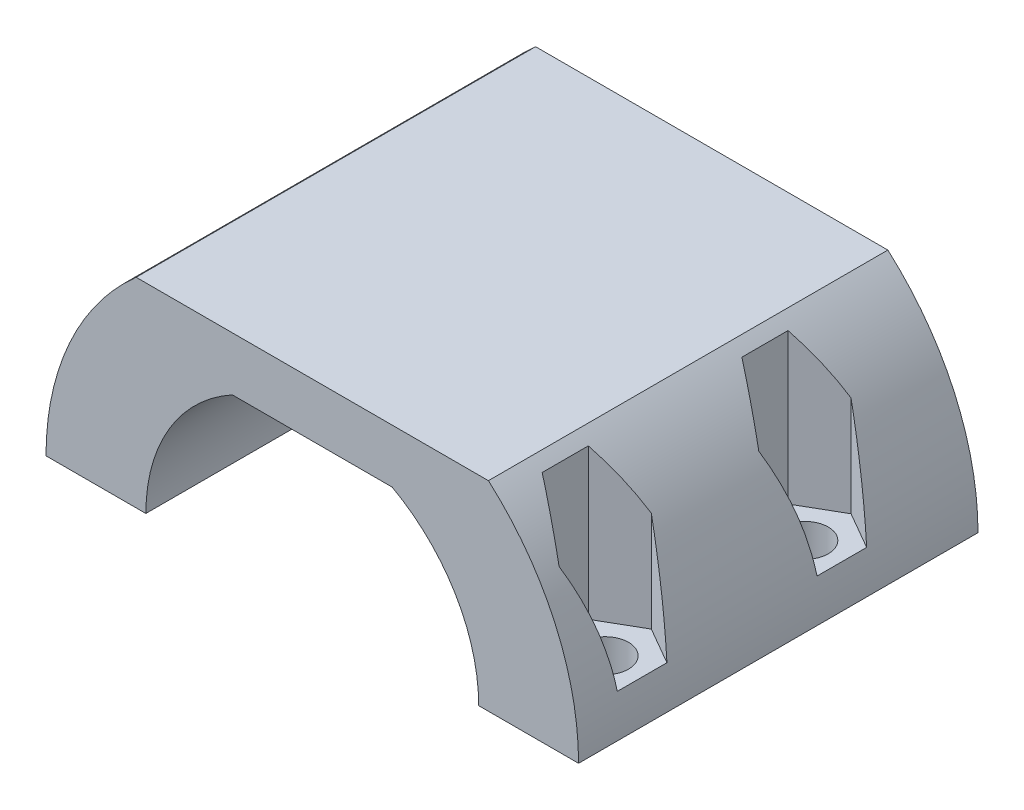
from build123d import *

# Parameters (mm, degrees)
BOSS_EXTRUDE1_DEPTH = 30
SKETCH2_R           = 1.75
CUT_EXTRUDE2_DEPTH  = 42.231056256
CUT_EXTRUDE3_DEPTH  = 40.862263024
SKETCH5_W           = 33.611871568
SKETCH5_H           = 10
CUT_EXTRUDE4_DEPTH  = 42.231056256


with BuildPart() as part:
    # Sketch1 → Boss-Extrude1 (new body)
    with BuildSketch(Plane.XY):
        with BuildLine():
            Line((-20, 0), (-12.5, 0))
            ThreePointArc((-12.5, 0), (-10.752906584, 6.373774392), (-6, 10.9658561))
            Line((-6, 10.9658561), (6, 10.9658561))
            ThreePointArc((6, 10.9658561), (10.752906584, 6.373774392), (12.5, 0))
            Line((12.5, 0), (20, 0))
            ThreePointArc((20, 0), (0, 20), (-20, 0))
        make_face()
    extrude(amount=BOSS_EXTRUDE1_DEPTH)

    # Sketch2 → Cut-Extrude2 (cut, through all)
    with BuildSketch(Plane(origin=(0, 0, 0), x_dir=(1, 0, 0), z_dir=(0, 1, 0))):
        with Locations(Location((-17, -10, 0), (0, 0, 90))):
            Circle(SKETCH2_R)
        with Locations(Location((17, -10, 0), (0, 0, 90))):
            Circle(SKETCH2_R)
        with Locations(Location((17, -25, 0), (0, 0, 90))):
            Circle(SKETCH2_R)
        with Locations(Location((-17, -25, 0), (0, 0, 90))):
            Circle(SKETCH2_R)
    extrude(amount=CUT_EXTRUDE2_DEPTH, mode=Mode.SUBTRACT)

    # Sketch4 → Cut-Extrude3 (cut, through all)
    with BuildSketch(Plane(origin=(0, 3, 0), x_dir=(1, 0, 0), z_dir=(0, 1, 0))):
        Polygon((-17, -6.535898385), (-20, -8.267949192), (-20, -11.732050808), (-17, -13.464101615), (-14, -11.732050808), (-14, -8.267949192), align=None)
        Polygon((-17, -21.535898385), (-20, -23.267949192), (-20, -26.732050808), (-17, -28.464101615), (-14, -26.732050808), (-14, -23.267949192), align=None)
        Polygon((17, -21.535898385), (14, -23.267949192), (14, -26.732050808), (17, -28.464101615), (20, -26.732050808), (20, -23.267949192), align=None)
        Polygon((14, -8.267949192), (14, -11.732050808), (17, -13.464101615), (20, -11.732050808), (20, -8.267949192), (17, -6.535898385), align=None)
    extrude(amount=CUT_EXTRUDE3_DEPTH, mode=Mode.SUBTRACT)

    # Sketch5 → Cut-Extrude4 (cut, through all)
    with BuildSketch(Plane.XY.offset(30)):
        with Locations((0, 20)):
            Rectangle(SKETCH5_W, SKETCH5_H)
    extrude(amount=-CUT_EXTRUDE4_DEPTH, mode=Mode.SUBTRACT)


solid = part.part
